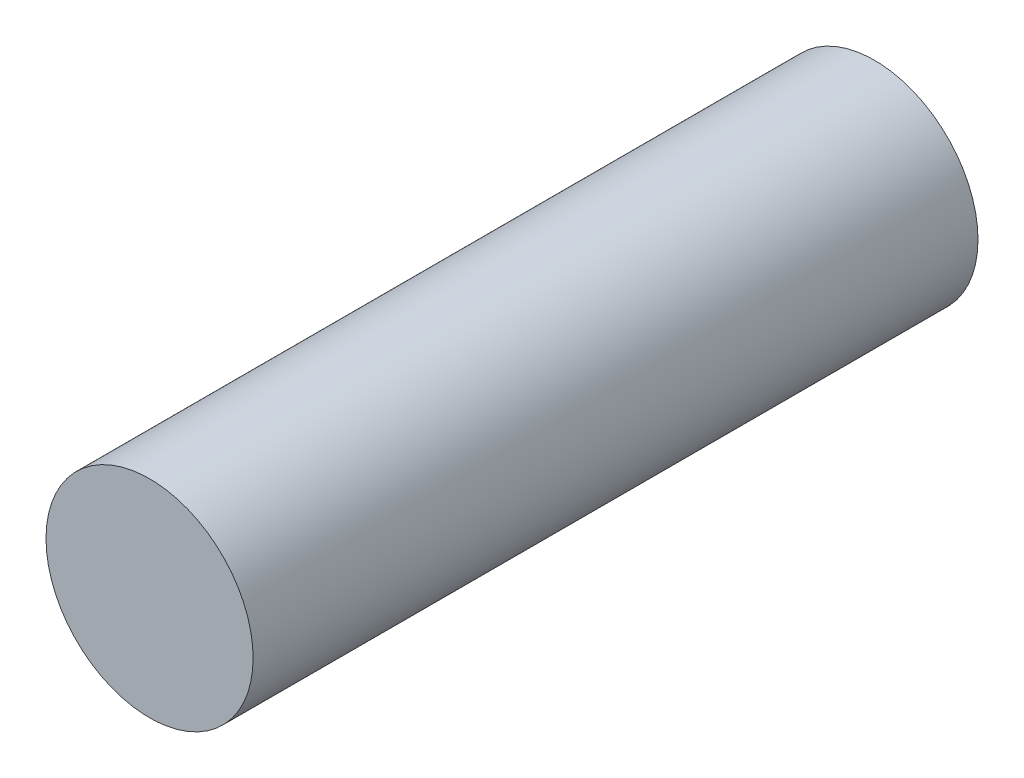
from build123d import *

# Parameters (mm, degrees)
SKETCH_1_R      = 1
EXTRUDE_1_DEPTH = 7


with BuildPart() as part:
    # 草图1 → 凸台-拉伸1 (new body)
    with BuildSketch(Plane.XY):
        Circle(SKETCH_1_R)
    extrude(amount=EXTRUDE_1_DEPTH)


solid = part.part
